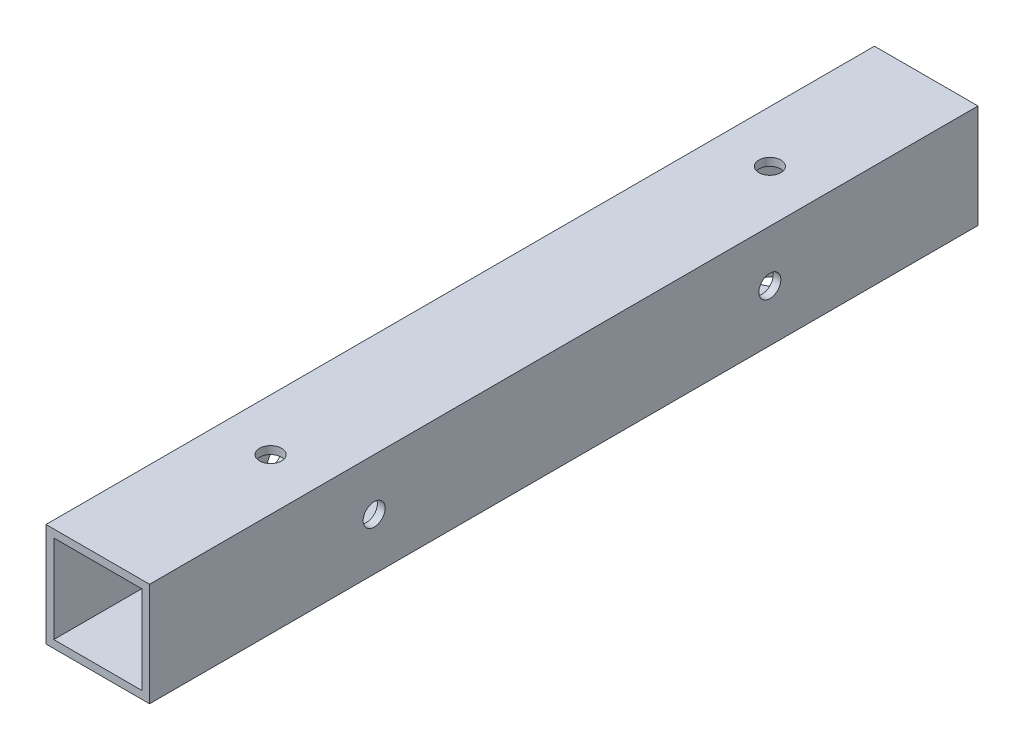
from build123d import *

# Parameters (mm, degrees)
SKETCH1_W           = 20
SKETCH1_H           = 20
SKETCH1_W_2         = 17
SKETCH1_H_2         = 17
BOSS_EXTRUDE1_DEPTH = 160
SKETCH2_R           = 2.125
CUT_EXTRUDE1_DEPTH  = 162.554944214
SKETCH3_R           = 2.125
CUT_EXTRUDE2_DEPTH  = 162.554944214


with BuildPart() as part:
    # Sketch1 → Boss-Extrude1 (new body)
    with BuildSketch(Plane.XY):
        Rectangle(SKETCH1_W, SKETCH1_H)
        Rectangle(SKETCH1_W_2, SKETCH1_H_2, mode=Mode.SUBTRACT)
    extrude(amount=-BOSS_EXTRUDE1_DEPTH)

    # Sketch2 → Cut-Extrude1 (cut, through all)
    with BuildSketch(Plane(origin=(0, 10, 0), x_dir=(1, 0, 0), z_dir=(0, 1, 0))):
        with Locations(Location((0, 33.375, 0), (0, 0, 270))):
            Circle(SKETCH2_R)
        with Locations(Location((0, 129.8, 0), (0, 0, 270))):
            Circle(SKETCH2_R)
    extrude(amount=-CUT_EXTRUDE1_DEPTH, mode=Mode.SUBTRACT)

    # Sketch3 → Cut-Extrude2 (cut, through all)
    with BuildSketch(Plane.ZY.offset(10)):
        with Locations((-43.375, 0)):
            Circle(SKETCH3_R)
        with Locations((-119.8, 0)):
            Circle(SKETCH3_R)
    extrude(amount=-CUT_EXTRUDE2_DEPTH, mode=Mode.SUBTRACT)


solid = part.part
